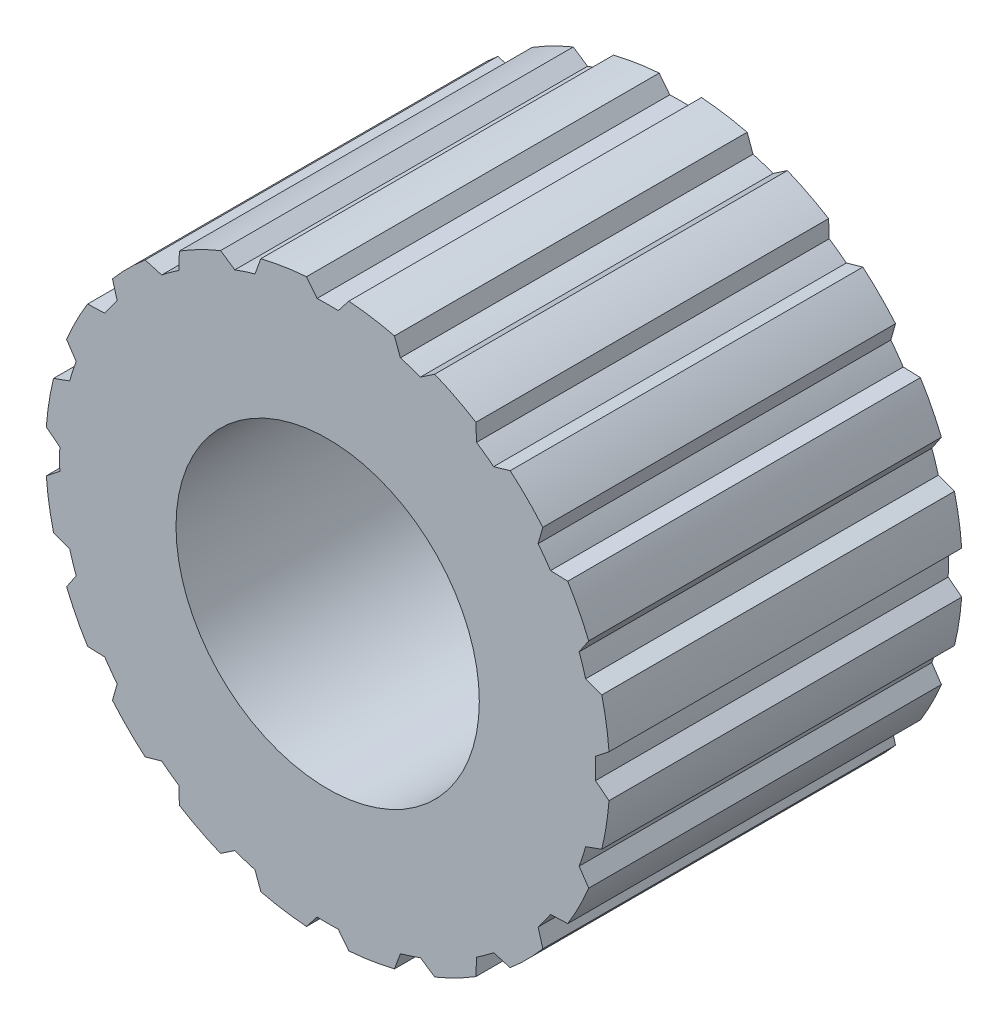
from build123d import *

# Parameters (mm, degrees)
BODYS_R                = 4
BODY_DEPTH             = 2.5
ENGAGEMENTCUT_DEPTH    = 7.184658438
ECCP_COUNT             = 20
MAJORDIAMETERCUTS_R    = 2.15
MAJORDIAMETERCUT_DEPTH = 8.537904218


with BuildPart() as part:
    # BodyS → Body (new, symmetric)
    with BuildSketch(Plane(origin=(0, 0, 0), x_dir=(-1, 0, 0), z_dir=(0, 0, -1))):
        Circle(BODYS_R)
    extrude(amount=BODY_DEPTH, both=True)

    # EngagementCutS → EngagementCut (cut, symmetric)
    with BuildSketch(Plane(origin=(0, 0, 0), x_dir=(-1, 0, 0), z_dir=(0, 0, -1))):
        with BuildLine():
            Line((0.3, 3.988734135), (0.15, 3.79703832))
            ThreePointArc((0.15, 3.79703832), (0, 3.8), (-0.15, 3.79703832))
            Line((-0.15, 3.79703832), (-0.3, 3.988734135))
            ThreePointArc((-0.3, 3.988734135), (0, 4), (0.3, 3.988734135))
        make_face()
    engagementcut = extrude(amount=ENGAGEMENTCUT_DEPTH, both=True, mode=Mode.SUBTRACT)

    # ECCP: EngagementCut ×20 about axis
    eccp_axis = Axis((0, 0, 51.25), (0, 0, -1))
    for i in range(1, ECCP_COUNT):
        add(engagementcut.rotate(eccp_axis, i * 360 / ECCP_COUNT), mode=Mode.SUBTRACT)

    # MajorDiameterCutS → MajorDiameterCut (cut, through all)
    with BuildSketch(Plane.XY.offset(2.5)):
        Circle(MAJORDIAMETERCUTS_R)
    extrude(amount=-MAJORDIAMETERCUT_DEPTH, mode=Mode.SUBTRACT)


solid = part.part
